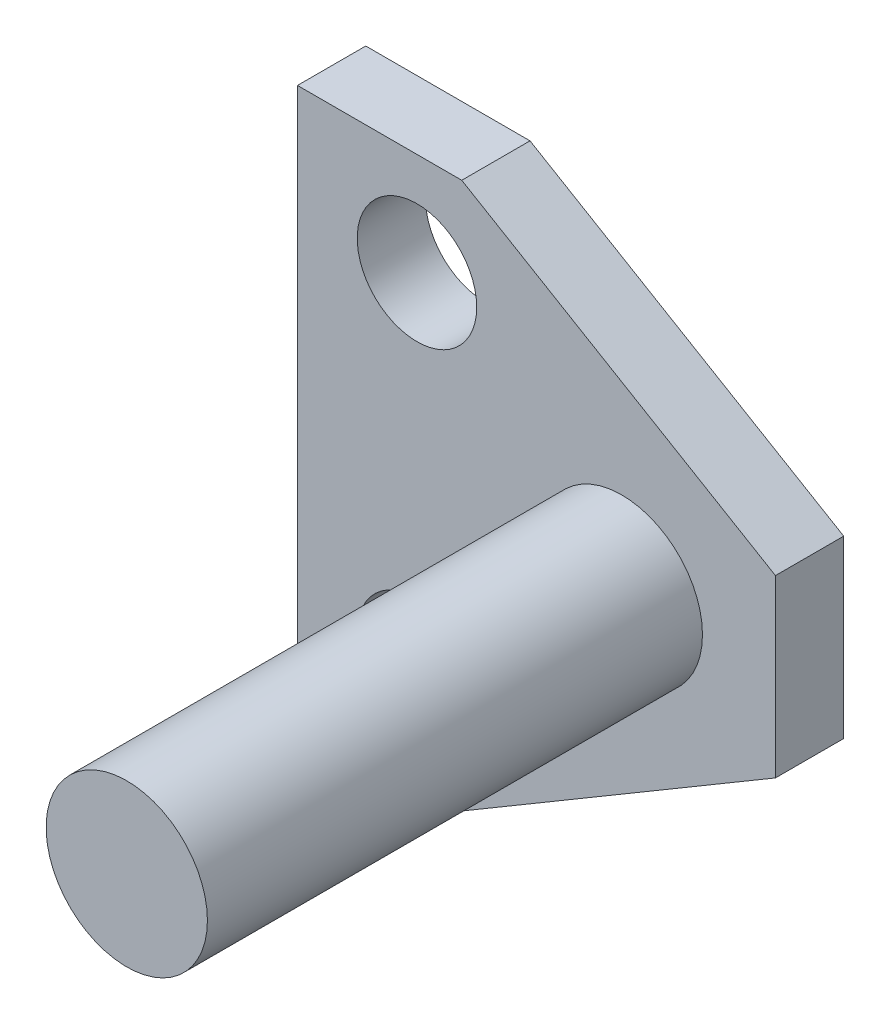
from build123d import *

# Parameters (mm, degrees)
SKETCH1_R           = 1.75
SKETCH1_R_2         = 2.3625
BOSS_EXTRUDE1_DEPTH = 2
SKETCH1_2_R         = 2.3625
BOSS_EXTRUDE2_DEPTH = 16.5


with BuildPart() as part:
    # Sketch1 → Boss-Extrude1 (new body)
    with BuildSketch(Plane.XY):
        Polygon((-9.5, -8), (-9.5, 8), (-4.688228281, 8), (4.5, 2.566962921), (4.5, -2.566962921), (-4.688228281, -8), align=None)
        with Locations((-6, -5)):
            Circle(SKETCH1_R, mode=Mode.SUBTRACT)
        with Locations((-6, 5)):
            Circle(SKETCH1_R, mode=Mode.SUBTRACT)
        Circle(SKETCH1_R_2, mode=Mode.SUBTRACT)
    extrude(amount=BOSS_EXTRUDE1_DEPTH)

    # Sketch1<2> → Boss-Extrude2 (add)
    with BuildSketch(Plane.XY):
        Circle(SKETCH1_2_R)
    extrude(amount=BOSS_EXTRUDE2_DEPTH)


solid = part.part
